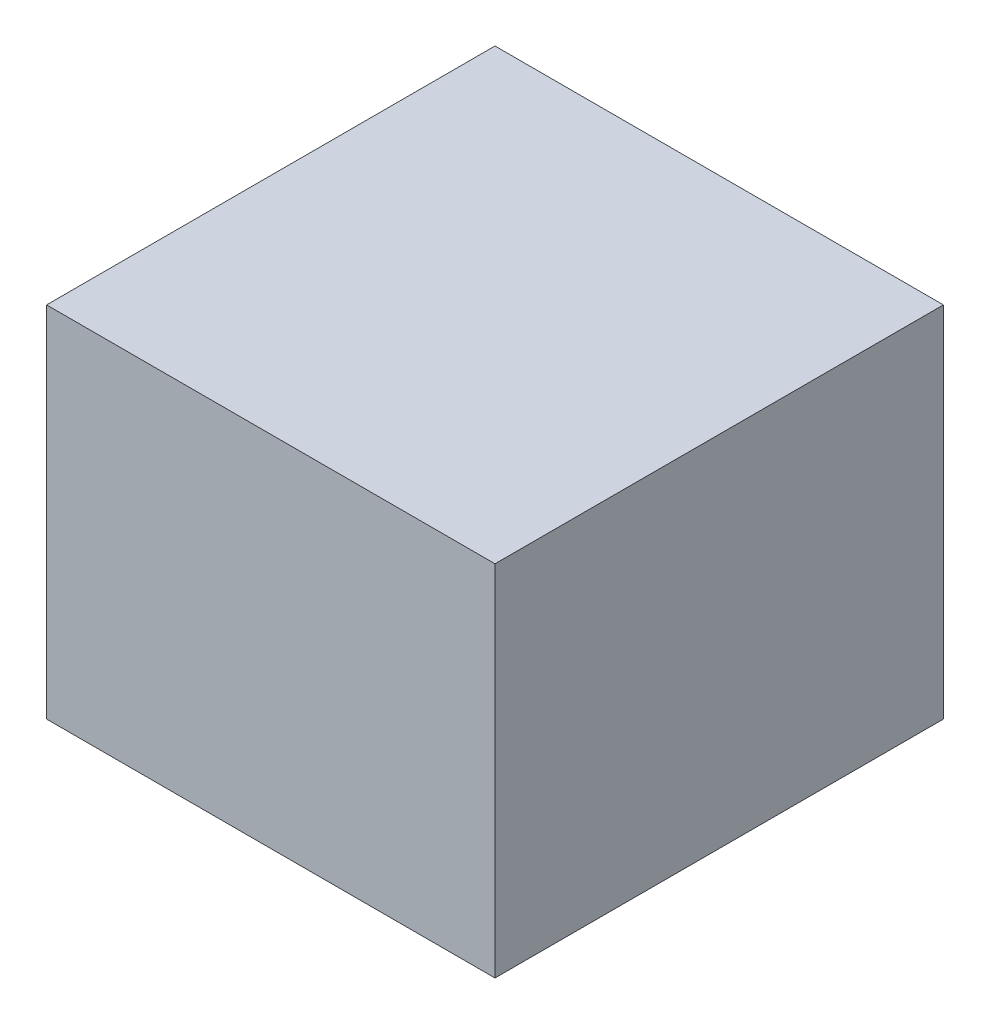
from build123d import *

# Parameters (mm, degrees)
SKETCH_1_W      = 50
SKETCH_1_H      = 50
EXTRUDE_1_DEPTH = 40


with BuildPart() as part:
    # Эскиз1 → Бобышка-Вытянуть1 (new body)
    with BuildSketch(Plane(origin=(0, 0, 0), x_dir=(1, 0, 0), z_dir=(0, 1, 0))):
        with Locations((25, -25)):
            Rectangle(SKETCH_1_W, SKETCH_1_H)
    extrude(amount=EXTRUDE_1_DEPTH)


solid = part.part
